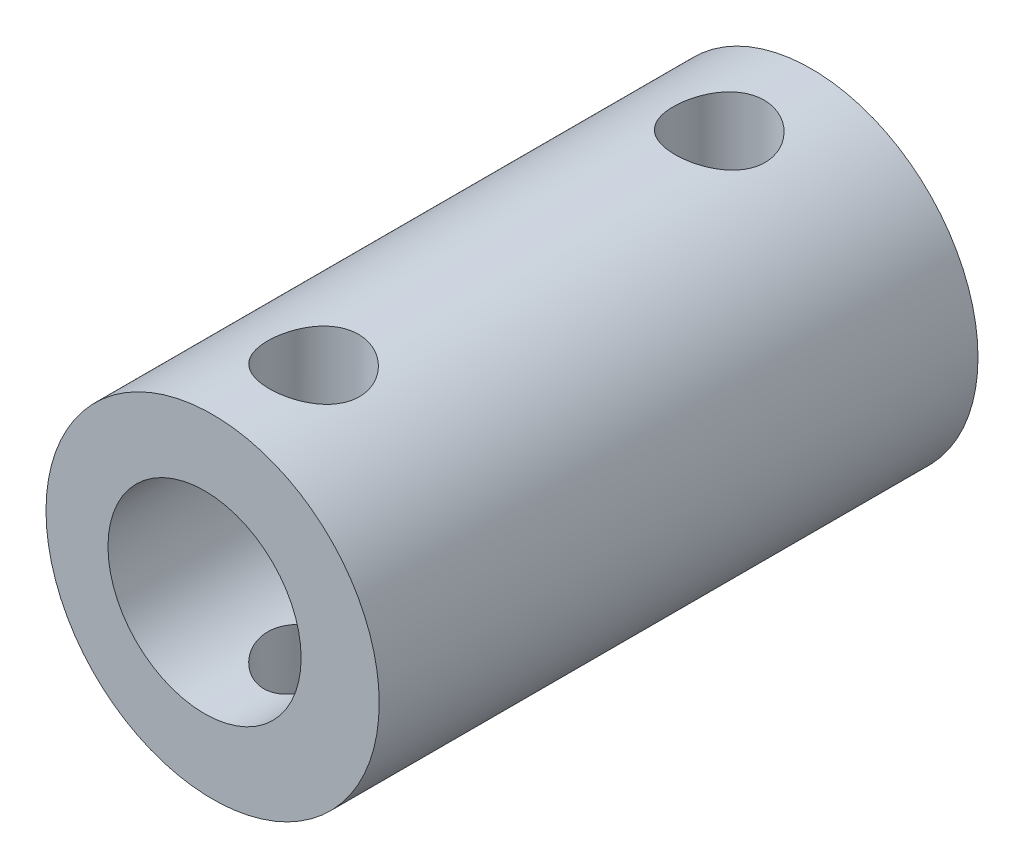
from build123d import *

# Parameters (mm, degrees)
SKETCH1_R           = 6.9
BOSS_EXTRUDE1_DEPTH = 24.8
SKETCH2_R           = 1.9
CUT_EXTRUDE1_DEPTH  = 24.8
SKETCH3_R           = 4
CUT_EXTRUDE2_DEPTH  = 10
SKETCH4_R           = 2
CUT_EXTRUDE3_DEPTH  = 10


with BuildPart() as part:
    # Sketch1 → Boss-Extrude1 (new body)
    with BuildSketch(Plane.XY):
        with Locations(Location((0.333575811, 0, 0), (0, 0, 180))):
            Circle(SKETCH1_R)
    extrude(amount=BOSS_EXTRUDE1_DEPTH)

    # Sketch2 → Cut-Extrude1 (cut)
    with BuildSketch(Plane(origin=(0, 6.9, 0), x_dir=(1, 0, 0), z_dir=(0, 1, 0))):
        with Locations(Location((0.515412316, -4, 0), (0, 0, 270))):
            Circle(SKETCH2_R)
        with Locations(Location((0.515412316, -20.8, 0), (0, 0, 270))):
            Circle(SKETCH2_R)
    extrude(amount=-CUT_EXTRUDE1_DEPTH, mode=Mode.SUBTRACT)

    # Sketch3 → Cut-Extrude2 (cut)
    with BuildSketch(Plane.XY.offset(24.8)):
        Circle(SKETCH3_R)
    extrude(amount=-CUT_EXTRUDE2_DEPTH, mode=Mode.SUBTRACT)

    # Sketch4 → Cut-Extrude3 (cut)
    with BuildSketch(Plane(origin=(0, 0, 0), x_dir=(-1, 0, 0), z_dir=(0, 0, -1))):
        Circle(SKETCH4_R)
    extrude(amount=-CUT_EXTRUDE3_DEPTH, mode=Mode.SUBTRACT)


solid = part.part
